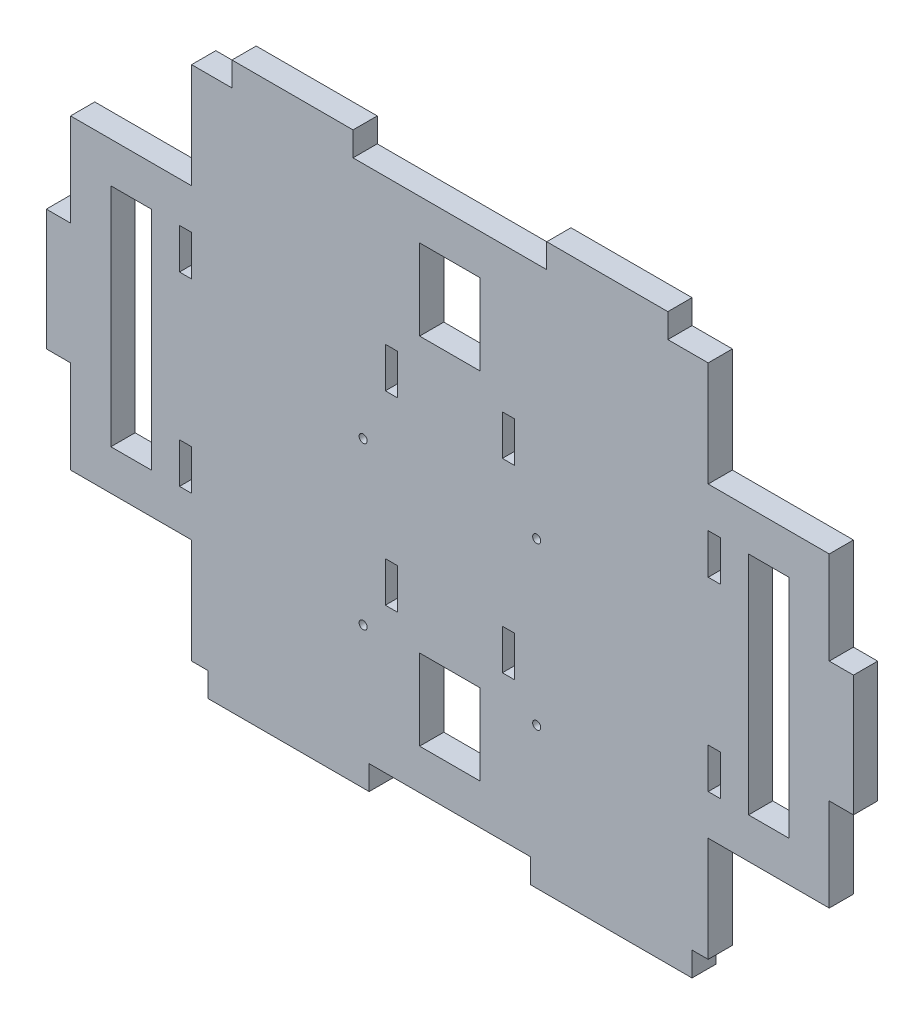
from build123d import *

# Parameters (mm, degrees)
BOSS_EXTRU_3_DEPTH      = 6
ESQUISSE2_W             = 3
ESQUISSE2_H             = 10
ENL_V_MAT_EXTRU_1_DEPTH = 10
ESQUISSE3_W             = 30
ESQUISSE3_H             = 26
ENL_V_MAT_EXTRU_2_DEPTH = 6
ESQUISSE4_W             = 15
ESQUISSE4_H             = 20
ENL_V_MAT_EXTRU_3_DEPTH = 6
ESQUISSE5_W             = 10
ESQUISSE5_H             = 56
ENL_V_MAT_EXTRU_4_DEPTH = 6
ESQUISSE6_R             = 1
ENL_V_MAT_EXTRU_5_DEPTH = 123.21292894
ESQUISSE7_W             = 16
ESQUISSE7_H             = 6
ENL_V_MAT_EXTRU_6_DEPTH = 1


with BuildPart() as part:
    # Esquisse1 → Boss.-Extru.3 (new body)
    with BuildSketch(Plane.XY):
        Polygon((-94, 64), (-94, 15), (-100, 15), (-100, -15), (-94, -15), (-94, -64), (-60, -64), (-60, -70), (-20, -70), (-20, -64), (20, -64), (20, -70), (60, -70), (60, -64), (94, -64), (94, -15), (100, -15), (100, 15), (94, 15), (94, 64), (54, 64), (54, 70), (24, 70), (24, 64), (-24, 64), (-24, 70), (-54, 70), (-54, 64), align=None)
    extrude(amount=BOSS_EXTRU_3_DEPTH)

    # Esquisse2 → Enlèv. mat.-Extru.1 (cut)
    with BuildSketch(Plane.XY.offset(6)):
        with Locations((-65.5, -23)):
            Rectangle(ESQUISSE2_W, ESQUISSE2_H)
        with Locations((-65.5, 23)):
            Rectangle(ESQUISSE2_W, ESQUISSE2_H)
        with Locations((-14.5, -23)):
            Rectangle(ESQUISSE2_W, ESQUISSE2_H)
        with Locations((-14.5, 23)):
            Rectangle(ESQUISSE2_W, ESQUISSE2_H)
        with Locations((65.5, -23)):
            Rectangle(ESQUISSE2_W, ESQUISSE2_H)
        with Locations((14.5, 23)):
            Rectangle(ESQUISSE2_W, ESQUISSE2_H)
        with Locations((14.5, -23)):
            Rectangle(ESQUISSE2_W, ESQUISSE2_H)
        with Locations((65.5, 23)):
            Rectangle(ESQUISSE2_W, ESQUISSE2_H)
    extrude(amount=-ENL_V_MAT_EXTRU_1_DEPTH, mode=Mode.SUBTRACT)

    # Esquisse3 → Enlèv. mat.-Extru.2 (cut)
    with BuildSketch(Plane.XY.offset(6)):
        with Locations((79, -51)):
            Rectangle(ESQUISSE3_W, ESQUISSE3_H)
        with Locations((-79, -51)):
            Rectangle(ESQUISSE3_W, ESQUISSE3_H)
        with Locations((-79, 51)):
            Rectangle(ESQUISSE3_W, ESQUISSE3_H)
        with Locations((79, 51)):
            Rectangle(ESQUISSE3_W, ESQUISSE3_H)
    extrude(amount=-ENL_V_MAT_EXTRU_2_DEPTH, mode=Mode.SUBTRACT)

    # Esquisse4 → Enlèv. mat.-Extru.3 (cut)
    with BuildSketch(Plane(origin=(0, 0, 0), x_dir=(-1, 0, 0), z_dir=(0, 0, -1))):
        with Locations((0, -44)):
            Rectangle(ESQUISSE4_W, ESQUISSE4_H)
        with Locations((0, 44)):
            Rectangle(ESQUISSE4_W, ESQUISSE4_H)
    extrude(amount=-ENL_V_MAT_EXTRU_3_DEPTH, mode=Mode.SUBTRACT)

    # Esquisse5 → Enlèv. mat.-Extru.4 (cut)
    with BuildSketch(Plane(origin=(0, 0, 0), x_dir=(-1, 0, 0), z_dir=(0, 0, -1))):
        with Locations((-79, 0)):
            Rectangle(ESQUISSE5_W, ESQUISSE5_H)
        with Locations((79, 0)):
            Rectangle(ESQUISSE5_W, ESQUISSE5_H)
    extrude(amount=-ENL_V_MAT_EXTRU_4_DEPTH, mode=Mode.SUBTRACT)

    # Esquisse6 → Enlèv. mat.-Extru.5 (cut, through all)
    with BuildSketch(Plane(origin=(0, 0, 0), x_dir=(-1, 0, 0), z_dir=(0, 0, -1))):
        with Locations((21.5, -35)):
            Circle(ESQUISSE6_R)
        with Locations((21.5, 5)):
            Circle(ESQUISSE6_R)
        with Locations(Location((-21.5, 5, 0), (0, 0, 180))):
            Circle(ESQUISSE6_R)
        with Locations(Location((-21.5, -35, 0), (0, 0, 180))):
            Circle(ESQUISSE6_R)
    extrude(amount=-ENL_V_MAT_EXTRU_5_DEPTH, mode=Mode.SUBTRACT)

    # Esquisse7 → Enlèv. mat.-Extru.6 (cut)
    with BuildSketch(Plane(origin=(0, 0, 0), x_dir=(-1, 0, 0), z_dir=(0, 0, -1))):
        with Locations((21.5, -35)):
            Rectangle(ESQUISSE7_W, ESQUISSE7_H)
        with Locations((21.5, 5)):
            Rectangle(ESQUISSE7_W, ESQUISSE7_H)
        with Locations((-21.5, 5)):
            Rectangle(ESQUISSE7_W, ESQUISSE7_H)
        with Locations((-21.5, -35)):
            Rectangle(ESQUISSE7_W, ESQUISSE7_H)
    extrude(amount=-ENL_V_MAT_EXTRU_6_DEPTH, mode=Mode.SUBTRACT)


solid = part.part
